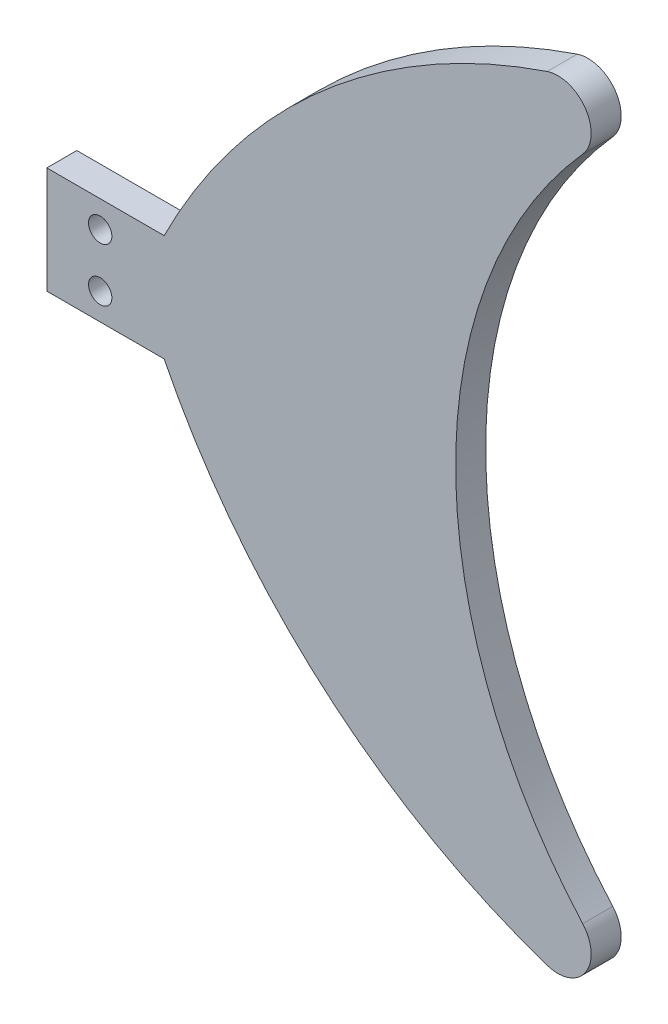
from build123d import *

# Parameters (mm, degrees)
EXTRUDE_1_DEPTH             = 4.5
SKETCH_2_R                  = 1.25
CUT_EXTRUDE_1_DEPTH         = 10
SKETCH_3_W                  = 12
SKETCH_3_H                  = 2
CUT_EXTRUDE_2_DEPTH         = 10
SKETCH_4_W                  = 13
SKETCH_4_H                  = 30
EXTRUDE_2_DEPTH             = 4
SKETCH_5_W                  = 13
SKETCH_5_H                  = 30
EXTRUDE_3_DEPTH             = 4
SKETCH_6_W                  = 13
SKETCH_6_H                  = 12.5
EXTRUDE_4_DEPTH             = 3
EXTRUDE_5_REACH             = 94.407
EXTRUDE_5_DIRECTION_2_REACH = 94.407
CUT_EXTRUDE_3_DEPTH         = 3
CUT_EXTRUDE_3_DEPTH_BACK    = 10.5
SKETCH_14_W                 = 13
SKETCH_14_H                 = 30
CUT_EXTRUDE_6_DEPTH         = 30
SKETCH_16_W                 = 13
SKETCH_16_H                 = 30
EXTRUDE_6_DEPTH             = 4.5
CUT_EXTRUDE_7_DEPTH         = 30
EXTRUDE_7_DEPTH             = 1
EXTRUDE_7_DEPTH_BACK        = 12
SKETCH_19_RX                = 16
SKETCH_19_RY                = 9
SKETCH_20_W                 = 4.5
SKETCH_20_H                 = 16.5
CUT_EXTRUDE_8_DEPTH         = 10.5
SKETCH_21_RX                = 19
SKETCH_21_RY                = 12
SKETCH_21_RX_2              = 16
SKETCH_21_RY_2              = 9
EXTRUDE_8_DEPTH             = 5
EXTRUDE_9_DEPTH             = 4.5
SKETCH_24_RX                = 22.349362986
SKETCH_24_RY                = 16.698081898
SKETCH_24_RX_2              = 16
SKETCH_24_RY_2              = 9
CUT_EXTRUDE_9_DEPTH         = 1
EXTRUDE_10_DEPTH            = 2
EXTRUDE_11_DEPTH            = 2
FILLET_2_R                  = 5
EXTRUDE_START               = -4.5
EXTRUDE_12_DEPTH            = 4.5
CUT_EXTRUDE_START           = -10
CUT_EXTRUDE_10_DEPTH        = 10
FILLET_3_R                  = 5
SKETCH_31_R                 = 27.637310688
CUT_EXTRUDE_11_DEPTH        = 11
SKETCH_32_W                 = 10.592360953
SKETCH_32_H                 = 40.503930122
SKETCH_32_W_2               = 11.438719886
CUT_EXTRUDE_12_DEPTH        = 10
CUT_EXTRUDE_13_DEPTH        = 10
SKETCH_34_W                 = 4.5
SKETCH_34_H                 = 40.503930122
EXTRUDE_14_DEPTH            = 20
CUT_EXTRUDE_14_DEPTH        = 15
CUT_EXTRUDE_16_DEPTH        = 10
EXTRUDE_15_DEPTH            = 4.5
CUT_EXTRUDE_17_DEPTH        = 10
SKETCH_45_W                 = 4.5
SKETCH_45_H                 = 16
EXTRUDE_17_DEPTH            = 9
SKETCH_46_R                 = 1.75
CUT_EXTRUDE_18_DEPTH        = 83.744717158


with BuildPart() as part:
    # 草图1 → 凸台-拉伸1 (new body)
    with BuildSketch(Plane.XY):
        with BuildLine():
            Line((6, 12), (37.748517734, 60))
            ThreePointArc((37.748517734, 60), (70, 0), (37.748517734, -60))
            Line((37.748517734, -60), (6, -12))
            Line((6, -12), (-6, -12))
            Line((-6, -12), (-6, 12))
            Line((-6, 12), (6, 12))
        make_face()
    extrude(amount=EXTRUDE_1_DEPTH)

    # 草图2 → 切除-拉伸1 (cut)
    with BuildSketch(Plane.XY.offset(4.5)):
        with Locations((0, 5)):
            Circle(SKETCH_2_R)
        with Locations((0, -5)):
            Circle(SKETCH_2_R)
    extrude(amount=-CUT_EXTRUDE_1_DEPTH, mode=Mode.SUBTRACT)

    # 草图3 → 切除-拉伸2 (cut)
    with BuildSketch(Plane.XY.offset(4.5)):
        with Locations((0, 11)):
            Rectangle(SKETCH_3_W, SKETCH_3_H)
        with Locations((0, -11)):
            Rectangle(SKETCH_3_W, SKETCH_3_H)
    extrude(amount=-CUT_EXTRUDE_2_DEPTH, mode=Mode.SUBTRACT)

    # 草图4 → 凸台-拉伸2 (add)
    with BuildSketch(Plane.XY.offset(4.5)):
        with Locations((2.5, 0)):
            Rectangle(SKETCH_4_W, SKETCH_4_H)
    extrude(amount=EXTRUDE_2_DEPTH)

    # 草图5 → 凸台-拉伸3 (add)
    with BuildSketch(Plane(origin=(0, 0, 0), x_dir=(-1, 0, 0), z_dir=(0, 0, -1))):
        with Locations((-2.5, 0)):
            Rectangle(SKETCH_5_W, SKETCH_5_H)
    extrude(amount=EXTRUDE_3_DEPTH)

    # 草图6 → 凸台-拉伸4 (add)
    with BuildSketch(Plane(origin=(0, 15, 0), x_dir=(1, 0, 0), z_dir=(0, 1, 0))):
        with Locations((2.5, -2.25)):
            Rectangle(SKETCH_6_W, SKETCH_6_H)
    extrude_4 = extrude(amount=-EXTRUDE_4_DEPTH)

    # 镜向1: 凸台-拉伸4 across plane
    add(extrude_4.mirror(Plane.ZX))

    # 凸台-拉伸5: up to this face of the body (flat: up to its plane)
    extrude_5_end = Plane(part.part.faces().sort_by_distance((39.824869212, 0, 4.5))[0])
    # 草图8 → 凸台-拉伸5 (add, up to the picked face)
    with BuildSketch(Plane.XY.offset(2.25), mode=Mode.PRIVATE) as extrude_5_sk1:
        Polygon((-4, 15), (37.748517734, 60), (7.984282358, 15), align=None)
    extrude_5_tool1 = split(extrude(extrude_5_sk1.sketch, amount=EXTRUDE_5_REACH, mode=Mode.PRIVATE), bisect_by=extrude_5_end, keep=Keep.BOTH, mode=Mode.PRIVATE)
    extrude_5 = extrude_5_tool1.solids().sort_by(Axis((13.910933, 30, 2.25), (0, 0, 1)))[0]
    add(extrude_5)

    # 凸台-拉伸5 direction 2: up to this face of the body (flat: up to its plane)
    extrude_5_direction_2_end = Plane(part.part.faces().sort_by_distance((39.824869212, 0, 0))[0])
    # 草图8 → 凸台-拉伸5 direction 2 (add, up to the picked face)
    with BuildSketch(Plane.XY.offset(2.25), mode=Mode.PRIVATE) as extrude_5_direction_2_sk1:
        Polygon((-4, 15), (37.748517734, 60), (7.984282358, 15), align=None)
    extrude_5_direction_2_tool1 = split(extrude(extrude_5_direction_2_sk1.sketch, amount=-EXTRUDE_5_DIRECTION_2_REACH, mode=Mode.PRIVATE), bisect_by=extrude_5_direction_2_end, keep=Keep.BOTH, mode=Mode.PRIVATE)
    extrude_5_direction_2 = extrude_5_direction_2_tool1.solids().sort_by(Axis((13.910933, 30, 2.25), (0, 0, -1)))[0]
    add(extrude_5_direction_2)

    # 镜向2: 凸台-拉伸5, 凸台-拉伸5 direction 2 across plane
    add(extrude_5.mirror(Plane.ZX))
    add(extrude_5_direction_2.mirror(Plane.ZX))

    # 草图9 → 切除-拉伸3 (cut, two sides: drawn at the far end of the back side and taken through both)
    with BuildSketch(Plane.ZY.offset(4).offset(-CUT_EXTRUDE_3_DEPTH_BACK)):
        Polygon((0, 10), (0, 12), (4.5, 12), (4.5, 10), (4.5, -10), (4.5, -12), (0, -12), (0, -10), align=None)
    extrude(amount=CUT_EXTRUDE_3_DEPTH + CUT_EXTRUDE_3_DEPTH_BACK, mode=Mode.SUBTRACT)

    # 草图14 → 切除-拉伸6 (cut)
    with BuildSketch(Plane.XY.offset(8.5)):
        with Locations((2.5, 0)):
            Rectangle(SKETCH_14_W, SKETCH_14_H)
    extrude(amount=-CUT_EXTRUDE_6_DEPTH, mode=Mode.SUBTRACT)

    # 草图16 → 凸台-拉伸6 (add)
    with BuildSketch(Plane.XY.offset(4.5)):
        with Locations((2.5, 0)):
            Rectangle(SKETCH_16_W, SKETCH_16_H)
    extrude(amount=-EXTRUDE_6_DEPTH)

    # 草图18 → 切除-拉伸7 (cut)
    with BuildSketch(Plane.XY.offset(4.5)):
        Polygon((37.748517734, 60), (6, 15), (-4, 15), align=None)
        Polygon((-4, -15), (37.748517734, -60), (6, -15), align=None)
    extrude(amount=-CUT_EXTRUDE_7_DEPTH, mode=Mode.SUBTRACT)

    # 草图19 → 凸台-拉伸7 (add, two sides: drawn at the far end of the back side and taken through both)
    with BuildSketch(Plane.ZY.offset(4).offset(-EXTRUDE_7_DEPTH_BACK)):
        with Locations(Location((2.25, 0), (0, 0, 90))):
            Ellipse(SKETCH_19_RX, SKETCH_19_RY)
    extrude(amount=EXTRUDE_7_DEPTH + EXTRUDE_7_DEPTH_BACK)

    # 草图20 → 切除-拉伸8 (cut)
    with BuildSketch(Plane.ZY.offset(5)):
        with Locations((2.25, 0)):
            Rectangle(SKETCH_20_W, SKETCH_20_H)
    extrude(amount=-CUT_EXTRUDE_8_DEPTH, mode=Mode.SUBTRACT)

    # 草图21 → 凸台-拉伸8 (add)
    with BuildSketch(Plane.ZY.offset(-5)):
        with Locations(Location((2.25, 0), (0, 0, 90))):
            Ellipse(SKETCH_21_RX, SKETCH_21_RY)
        with Locations(Location((2.25, 0), (0, 0, 90))):
            Ellipse(SKETCH_21_RX_2, SKETCH_21_RY_2, mode=Mode.SUBTRACT)
    extrude(amount=-EXTRUDE_8_DEPTH)

    # 草图23 → 凸台-拉伸9 (add)
    with BuildSketch(Plane.XY.offset(4.5)):
        Polygon((5, 19), (37.748517734, 60), (10, 17.267716944), (5, 17.267716944), align=None)
    extrude_9 = extrude(amount=-EXTRUDE_9_DEPTH)

    # 镜向4: 凸台-拉伸9 across plane
    add(extrude_9.mirror(Plane.ZX))

    # 草图24 → 切除-拉伸9 (cut)
    with BuildSketch(Plane.ZY.offset(-5)):
        with Locations(Location((0, 0), (0, 0, 95.777984299))):
            Ellipse(SKETCH_24_RX, SKETCH_24_RY)
        with Locations(Location((2.25, 0), (0, 0, 90))):
            Ellipse(SKETCH_24_RX_2, SKETCH_24_RY_2, mode=Mode.SUBTRACT)
    extrude(amount=-CUT_EXTRUDE_9_DEPTH, mode=Mode.SUBTRACT)

    # 草图25 → 凸台-拉伸10 (add)
    with BuildSketch(Plane(origin=(8, 0, 0), x_dir=(0, 0, -1), z_dir=(1, 0, 0))):
        with BuildLine():
            Line((-4.5, -15.491933385), (-4.5, 15.491933385))
            add(Edge.make_bspline(
                [(-4.5, 15.491933385), (-11.25, 12.393546708), (-11.25, 0), (-11.25, -12.393546708), (-4.5, -15.491933385)],
                knots=[0.252680255, 0.252680255, 0.252680255, 1.570796327, 1.570796327, 2.888912398, 2.888912398, 2.888912398], degree=2, weights=[1, 0.790569415, 1, 0.790569415, 1]))
        make_face()
    extrude(amount=EXTRUDE_10_DEPTH)

    # 草图26 → 凸台-拉伸11 (add)
    with BuildSketch(Plane(origin=(8, 0, 0), x_dir=(0, 0, -1), z_dir=(1, 0, 0))):
        with BuildLine():
            Line((0, 15.491933385), (0, -15.491933385))
            add(Edge.make_bspline(
                [(0, -15.491933385), (6.75, -12.393546708), (6.75, 0), (6.75, 12.393546708), (0, 15.491933385)],
                knots=[3.394272909, 3.394272909, 3.394272909, 4.71238898, 4.71238898, 6.030505052, 6.030505052, 6.030505052], degree=2, weights=[1, 0.790569415, 1, 0.790569415, 1]))
        make_face()
    extrude(amount=EXTRUDE_11_DEPTH)

    # 圆角2
    fillet_2_edges = [part.edges().sort_by_distance(p)[0] for p in [
        (37.748517734, 60, 2.25),
        (37.748517734, -60, 2.25),
    ]]
    fillet(fillet_2_edges, radius=FILLET_2_R)

    # 草图29 → 凸台-拉伸12 (add)
    with BuildSketch(Plane.XY.offset(4.5).offset(EXTRUDE_START)):
        with BuildLine():
            ThreePointArc((46.097120384, 53.550550283), (63.753039684, 29.321532572), (70, 0))
            Line((70, 0), (80, 0))
            ThreePointArc((80, 0), (73.182189143, 32.722792613), (53.863347086, 60))
            Line((53.863347086, 60), (46.097120384, 53.550550283))
        make_face()
        with BuildLine():
            Line((80, 0), (70, 0))
            ThreePointArc((70, 0), (63.753039684, -29.321532572), (46.097120384, -53.550550283))
            Line((46.097120384, -53.550550283), (53.863347086, -60))
            ThreePointArc((53.863347086, -60), (73.182189143, -32.722792613), (80, 0))
        make_face()
    extrude(amount=EXTRUDE_12_DEPTH)

    # 草图29<3> → 切除-拉伸10 (cut)
    with BuildSketch(Plane.XY.offset(4.5).offset(CUT_EXTRUDE_START)):
        with BuildLine():
            Line((41.159029862, 69.687977685), (6, 20.251965061))
            Line((6, 20.251965061), (34.798527096, 56.306714791))
            ThreePointArc((34.798527096, 56.306714791), (38.095970697, 58.148969105), (41.741126059, 57.159081415))
            ThreePointArc((41.741126059, 57.159081415), (43.954604918, 55.397647146), (46.097120384, 53.550550283))
            Line((46.097120384, 53.550550283), (53.863347086, 60))
            ThreePointArc((53.863347086, 60), (47.747882107, 65.154376737), (41.159029862, 69.687977685))
        make_face()
        with BuildLine():
            Line((53.863347086, -60), (46.097120384, -53.550550283))
            ThreePointArc((46.097120384, -53.550550283), (43.954604918, -55.397647146), (41.741126059, -57.159081415))
            ThreePointArc((41.741126059, -57.159081415), (38.095970697, -58.148969105), (34.798527096, -56.306714791))
            Line((34.798527096, -56.306714791), (6, -20.251965061))
            Line((6, -20.251965061), (41.159029862, -69.687977685))
            ThreePointArc((41.159029862, -69.687977685), (47.747882107, -65.154376737), (53.863347086, -60))
        make_face()
        with BuildLine():
            ThreePointArc((41.741126059, -57.159081415), (43.954604918, -55.397647146), (46.097120384, -53.550550283))
            Line((46.097120384, -53.550550283), (6, -20.251965061))
            Line((6, -20.251965061), (34.798527096, -56.306714791))
            ThreePointArc((34.798527096, -56.306714791), (38.095970697, -58.148969105), (41.741126059, -57.159081415))
        make_face()
        with BuildLine():
            Line((34.798527096, 56.306714791), (6, 20.251965061))
            Line((6, 20.251965061), (46.097120384, 53.550550283))
            ThreePointArc((46.097120384, 53.550550283), (43.954604918, 55.397647146), (41.741126059, 57.159081415))
            ThreePointArc((41.741126059, 57.159081415), (38.095970697, 58.148969105), (34.798527096, 56.306714791))
        make_face()
    extrude(amount=CUT_EXTRUDE_10_DEPTH, mode=Mode.SUBTRACT)

    # 圆角3
    fillet_3_edges = [part.edges().sort_by_distance(p)[0] for p in [
        (53.863347086, 60, 2.25),
        (53.863347086, -60, 2.25),
    ]]
    fillet(fillet_3_edges, radius=FILLET_3_R)

    # 草图31 → 切除-拉伸11 (cut)
    with BuildSketch(Plane.ZY.offset(5)):
        Circle(SKETCH_31_R)
    extrude(amount=-CUT_EXTRUDE_11_DEPTH, mode=Mode.SUBTRACT)

    # 草图32 → 切除-拉伸12 (cut)
    with BuildSketch(Plane.ZY.offset(-6)):
        with Locations((-5.296180477, 0)):
            Rectangle(SKETCH_32_W, SKETCH_32_H)
        with Locations((10.219359943, 0)):
            Rectangle(SKETCH_32_W_2, SKETCH_32_H)
    extrude(amount=-CUT_EXTRUDE_12_DEPTH, mode=Mode.SUBTRACT)

    # 草图33 → 切除-拉伸13 (cut)
    with BuildSketch(Plane(origin=(0, 0, 0), x_dir=(-1, 0, 0), z_dir=(0, 0, -1)).offset(CUT_EXTRUDE_START)):
        with BuildLine():
            ThreePointArc((-57.310429263, 49.936174191), (-58.57903266, 53.35553569), (-57.187792246, 56.726861505))
            ThreePointArc((-57.187792246, 56.726861505), (-80, 0), (-57.187792246, -56.726861505))
            ThreePointArc((-57.187792246, -56.726861505), (-58.57903266, -53.35553569), (-57.310429263, -49.936174191))
            ThreePointArc((-57.310429263, -49.936174191), (-38.269150721, 0), (-57.310429263, 49.936174191))
        make_face()
    extrude(amount=CUT_EXTRUDE_13_DEPTH, mode=Mode.SUBTRACT)

    # 草图34 → 凸台-拉伸14 (add)
    with BuildSketch(Plane.ZY.offset(-6)):
        with Locations((2.25, 0)):
            Rectangle(SKETCH_34_W, SKETCH_34_H)
    extrude(amount=EXTRUDE_14_DEPTH)

    # 草图37 → 切除-拉伸14 (cut)
    with BuildSketch(Plane.XY.offset(4.5)):
        Polygon((-14, 15), (-0.324252934, 15), (6, 20.251965061), (-14, 20.251965061), align=None)
        Polygon((6, -20.251965061), (-0.324252934, -15), (-14, -15), (-14, -20.251965061), align=None)
    extrude(amount=-CUT_EXTRUDE_14_DEPTH, mode=Mode.SUBTRACT)

    # 草图39 → 切除-拉伸16 (cut)
    with BuildSketch(Plane.XY.offset(4.5)):
        Polygon((-0.324252934, 15), (-2.732590713, 13), (-15.121772597, 13), (-15.121772597, 15), align=None)
        Polygon((-15.121772597, -15), (-0.324252934, -15), (-2.732590713, -13), (-15.121772597, -13), align=None)
    extrude(amount=-CUT_EXTRUDE_16_DEPTH, mode=Mode.SUBTRACT)

    # 草图41 → 凸台-拉伸15 (add)
    with BuildSketch(Plane.XY.offset(4.5)):
        with BuildLine():
            ThreePointArc((51.977234617, 58.001456739), (20.503949317, 40.507576232), (-2.732590713, 13))
            Line((-2.732590713, 13), (50.385479815, 57.111811058))
            ThreePointArc((50.385479815, 57.111811058), (51.140457622, 57.629811486), (51.977234617, 58.001456739))
        make_face()
    extrude_15 = extrude(amount=-EXTRUDE_15_DEPTH)

    # 镜向6: 凸台-拉伸15 across plane
    add(extrude_15.mirror(Plane.ZX))

    # 草图42 → 切除-拉伸17 (cut)
    with BuildSketch(Plane.XY.offset(4.5)):
        with BuildLine():
            Line((-14, 13), (-14, 8))
            Line((-14, 8), (-5.412585603, 8))
            ThreePointArc((-5.412585603, 8), (-4.108051236, 10.519008174), (-2.732590713, 13))
            Line((-2.732590713, 13), (-14, 13))
        make_face()
    cut_extrude_17 = extrude(amount=-CUT_EXTRUDE_17_DEPTH, mode=Mode.SUBTRACT)

    # 镜向7: 切除-拉伸17 across plane
    add(cut_extrude_17.mirror(Plane.ZX), mode=Mode.SUBTRACT)

    # 草图45 → 凸台-拉伸17 (add)
    with BuildSketch(Plane.ZY.offset(14)):
        with Locations((2.25, 0)):
            Rectangle(SKETCH_45_W, SKETCH_45_H)
    extrude(amount=EXTRUDE_17_DEPTH)

    # 草图46 → 切除-拉伸18 (cut, through all)
    with BuildSketch(Plane.XY.offset(4.5)):
        with Locations((-15, 4)):
            Circle(SKETCH_46_R)
        with Locations(Location((-15, -4, 0), (0, 0, 180))):
            Circle(SKETCH_46_R)
    extrude(amount=-CUT_EXTRUDE_18_DEPTH, mode=Mode.SUBTRACT)


solid = part.part
